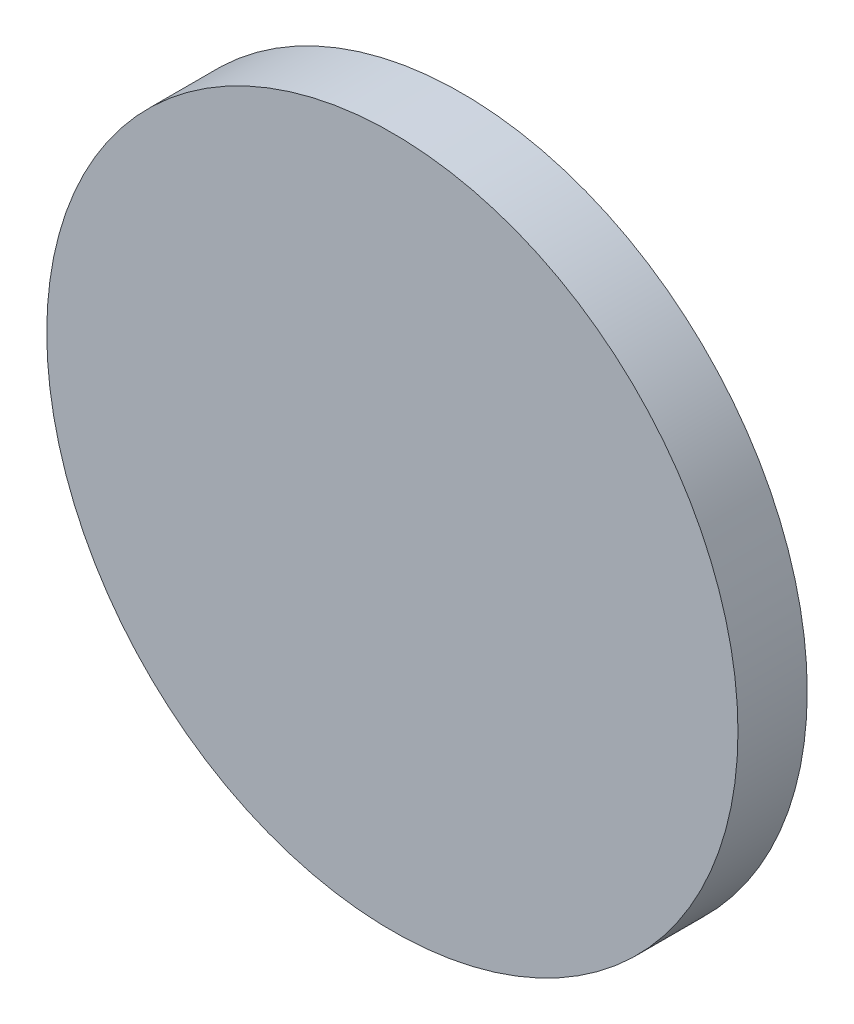
from build123d import *

# Parameters (mm, degrees)
ESQUISSE1_R        = 11.625
BOSS_EXTRU_1_DEPTH = 2.33


with BuildPart() as part:
    # Esquisse1 → Boss.-Extru.1 (new body)
    with BuildSketch(Plane.XY):
        Circle(ESQUISSE1_R)
    extrude(amount=BOSS_EXTRU_1_DEPTH)


solid = part.part
